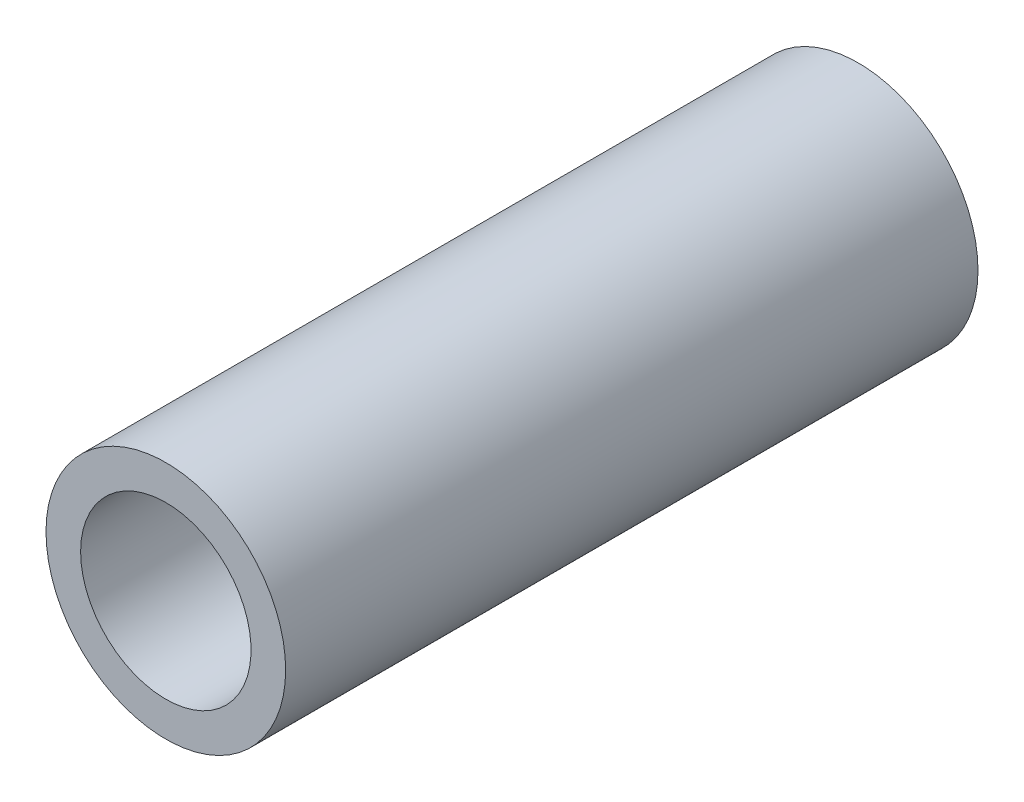
from build123d import *

# Parameters (mm, degrees)
SKETCH1_R      = 2.25
SKETCH1_R_2    = 1.6
EXTRUDE1_DEPTH = 6.5


with BuildPart() as part:
    # Sketch1 → Extrude1 (new, symmetric)
    with BuildSketch(Plane.XY):
        with Locations(Location((0, 0, 0), (0, 0, 180))):
            Circle(SKETCH1_R)
        with Locations(Location((0, 0, 0), (0, 0, 180))):
            Circle(SKETCH1_R_2, mode=Mode.SUBTRACT)
    extrude(amount=EXTRUDE1_DEPTH, both=True)


solid = part.part
